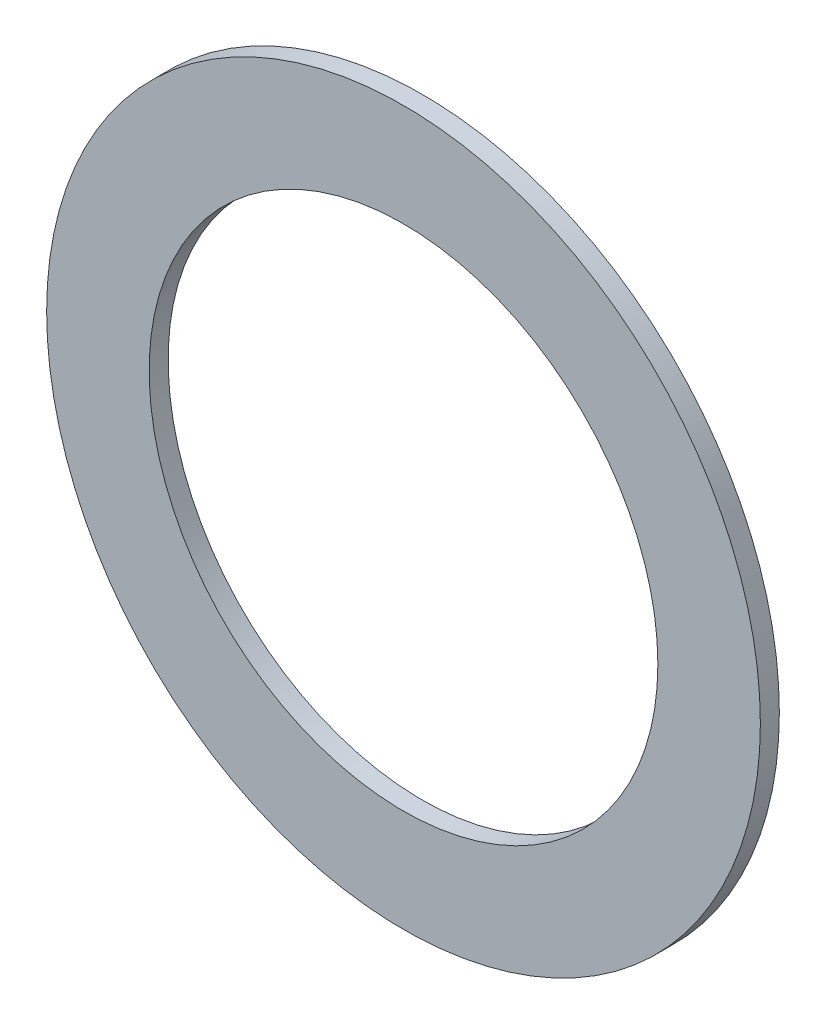
from build123d import *

# Parameters (mm, degrees)
IZIM1_R                     = 9.4
IZIM1_R_2                   = 6.7
Y_KSEKLIK_EKSTR_ZYON1_DEPTH = 0.5


with BuildPart() as part:
    # Çizim1 → Yükseklik-Ekstrüzyon1 (new body)
    with BuildSketch(Plane.XY):
        Circle(IZIM1_R)
        Circle(IZIM1_R_2, mode=Mode.SUBTRACT)
    extrude(amount=Y_KSEKLIK_EKSTR_ZYON1_DEPTH)


solid = part.part
